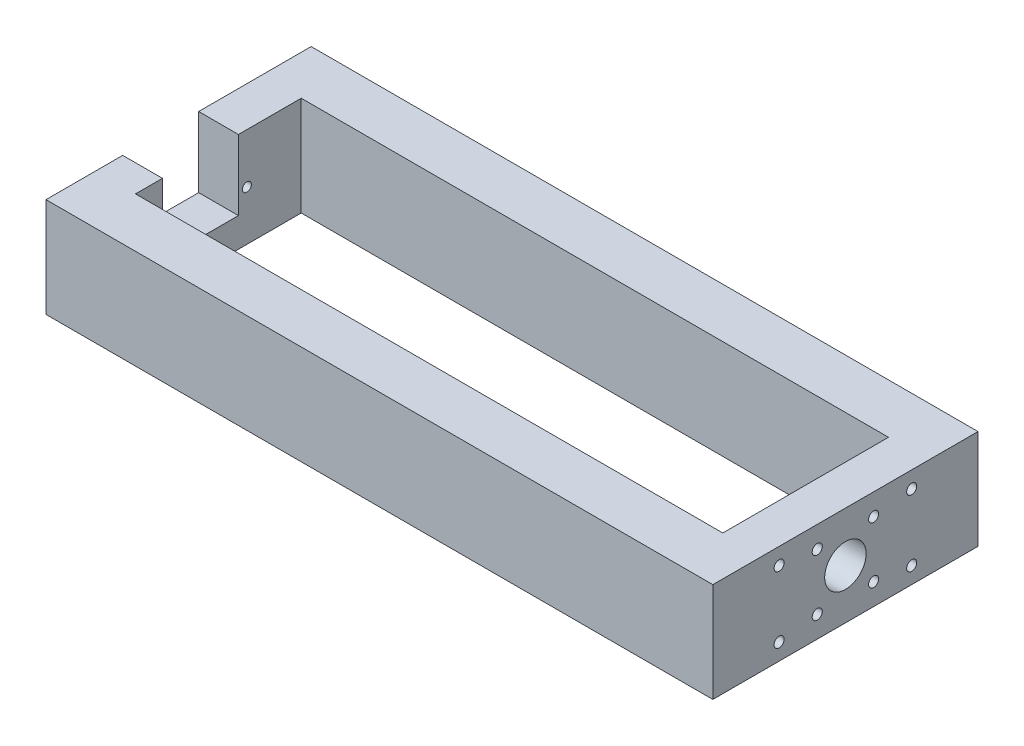
from build123d import *

# Parameters (mm, degrees)
SKETCH1_W           = 201.19
SKETCH1_H           = 80
SKETCH1_W_2         = 177.19
SKETCH1_H_2         = 50
BOSS_EXTRUDE1_DEPTH = 30
SKETCH2_R           = 1.35
SKETCH2_W           = 22.92
SKETCH2_H           = 21.2
CUT_EXTRUDE1_DEPTH  = 30
SKETCH4_R           = 6.25
SKETCH4_R_2         = 1.52
CUT_EXTRUDE2_DEPTH  = 30


with BuildPart() as part:
    # Sketch1 → Boss-Extrude1 (new body)
    with BuildSketch(Plane(origin=(0, 0, 0), x_dir=(1, 0, 0), z_dir=(0, 1, 0))):
        with Locations((30.629887821, -19.526338141)):
            Rectangle(SKETCH1_W, SKETCH1_H)
        with Locations((30.629887821, -19.526338141)):
            Rectangle(SKETCH1_W_2, SKETCH1_H_2, mode=Mode.SUBTRACT)
    extrude(amount=BOSS_EXTRUDE1_DEPTH)

    # Sketch2 → Cut-Extrude1 (cut)
    with BuildSketch(Plane.ZY.offset(69.965112179)):
        with Locations((10.926338141, 15)):
            Circle(SKETCH2_R)
        with Locations((38.926338141, 15)):
            Circle(SKETCH2_R)
        with Locations((24.926338141, 19.4)):
            Rectangle(SKETCH2_W, SKETCH2_H)
    extrude(amount=-CUT_EXTRUDE1_DEPTH, mode=Mode.SUBTRACT)

    # Sketch4 → Cut-Extrude2 (cut)
    with BuildSketch(Plane(origin=(131.224887821, 0, 0), x_dir=(0, 0, -1), z_dir=(1, 0, 0))):
        with Locations((-19.526338141, 15)):
            Circle(SKETCH4_R)
        with Locations((-28.026338141, 23.5)):
            Circle(SKETCH4_R_2)
        with Locations((-11.026338141, 23.5)):
            Circle(SKETCH4_R_2)
        with Locations((-11.026338141, 6.5)):
            Circle(SKETCH4_R_2)
        with Locations((-28.026338141, 6.5)):
            Circle(SKETCH4_R_2)
        with Locations((0.473661859, 25)):
            Circle(SKETCH4_R_2)
        with Locations((0.473661859, 5)):
            Circle(SKETCH4_R_2)
        with Locations((-39.526338141, 5)):
            Circle(SKETCH4_R_2)
        with Locations((-39.526338141, 25)):
            Circle(SKETCH4_R_2)
    extrude(amount=-CUT_EXTRUDE2_DEPTH, mode=Mode.SUBTRACT)


solid = part.part
